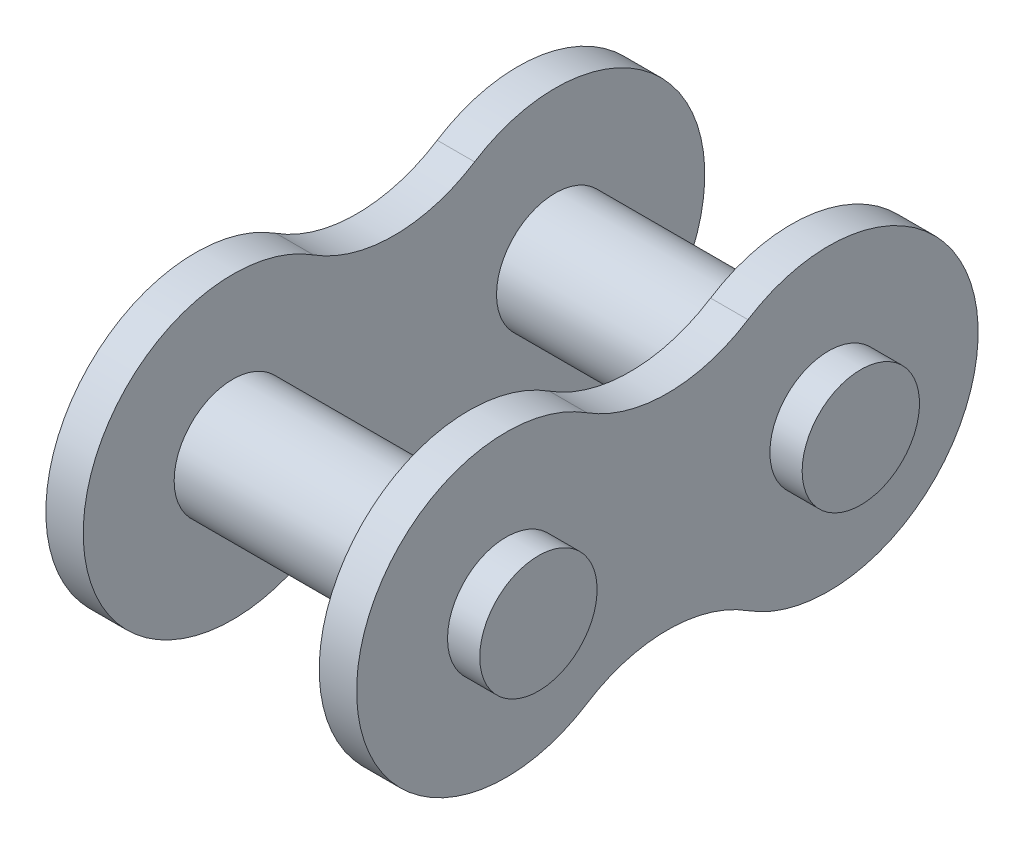
from build123d import *

# Parameters (mm, degrees)
BOSS_EXTRUDE1_DEPTH = 0.7366
SKETCH2_R           = 1.1557
BOSS_EXTRUDE2_DEPTH = 4.6482
BOSS_EXTRUDE3_START = 0.635
SKETCH3_R           = 1.1557
BOSS_EXTRUDE3_DEPTH = 0.635


with BuildPart() as part:
    # Sketch1 → Boss-Extrude1 (new body)
    with BuildSketch(Plane(origin=(0, 0, 0), x_dir=(0, 0, -1), z_dir=(1, 0, 0))):
        with BuildLine():
            ThreePointArc((1.5875, 2.482159687), (-2.9464, 0), (1.5875, -2.482159687))
            ThreePointArc((1.5875, -2.482159687), (3.175, -2.017919373), (4.7625, -2.482159687))
            ThreePointArc((4.7625, -2.482159687), (9.2964, 0), (4.7625, 2.482159687))
            ThreePointArc((4.7625, 2.482159687), (3.175, 2.017919373), (1.5875, 2.482159687))
        make_face()
    boss_extrude1 = extrude(amount=BOSS_EXTRUDE1_DEPTH)

    # Sketch2 → Boss-Extrude2 (add)
    with BuildSketch(Plane(origin=(0.7366, 0, 0), x_dir=(0, 0, -1), z_dir=(1, 0, 0))):
        with Locations(Location((0, 0, 0), (0, 0, 180))):
            Circle(SKETCH2_R)
        with Locations(Location((6.35, 0, 0), (0, 0, 180))):
            Circle(SKETCH2_R)
    extrude(amount=BOSS_EXTRUDE2_DEPTH)

    # Sketch3 → Boss-Extrude3 (add)
    with BuildSketch(Plane.ZY.offset(BOSS_EXTRUDE3_START)):
        Circle(SKETCH3_R)
        with Locations((-6.35, 0)):
            Circle(SKETCH3_R)
    boss_extrude3 = extrude(amount=-BOSS_EXTRUDE3_DEPTH)

    # Mirror1: Boss-Extrude1, Boss-Extrude3 across plane
    add(boss_extrude1.mirror(Plane(origin=(3.0607, 0, 0), x_dir=(0, 0, 1), z_dir=(1, 0, 0))))
    add(boss_extrude3.mirror(Plane(origin=(3.0607, 0, 0), x_dir=(0, 0, 1), z_dir=(1, 0, 0))))


solid = part.part
